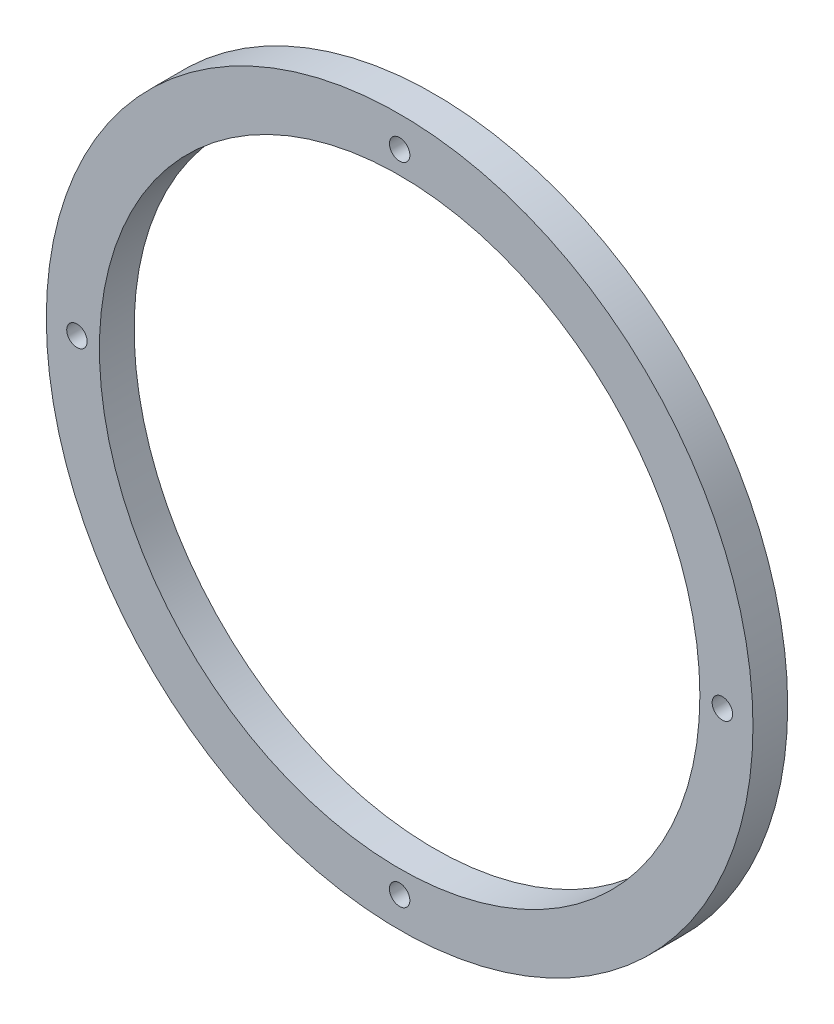
from build123d import *

# Parameters (mm, degrees)
SKETCH_1_R                   = 86.5
SKETCH_1_R_2                 = 73.5
SKETCH_1_R_3                 = 2.5
EXTRUDE_1_DEPTH              = 8.5
HOLE_WIZARD_M4_1_D           = 4.8
HOLE_WIZARD_M4_1_CSINK_D     = 9.4
HOLE_WIZARD_M4_1_CSINK_ANGLE = 90


with BuildPart() as part:
    # ｽｹｯﾁ1 → ﾎﾞｽ - 押し出し1 (new body)
    with BuildSketch(Plane.XY):
        Circle(SKETCH_1_R)
        Circle(SKETCH_1_R_2, mode=Mode.SUBTRACT)
        with Locations((0, 79)):
            Circle(SKETCH_1_R_3, mode=Mode.SUBTRACT)
        with Locations((79, 0)):
            Circle(SKETCH_1_R_3, mode=Mode.SUBTRACT)
        with Locations((0, -79)):
            Circle(SKETCH_1_R_3, mode=Mode.SUBTRACT)
        with Locations((-79, 0)):
            Circle(SKETCH_1_R_3, mode=Mode.SUBTRACT)
    extrude(amount=EXTRUDE_1_DEPTH)

    # M4 丸皿ねじ用皿穴1 (through all)
    with Locations(Plane(origin=(0, 0, 0), x_dir=(-1, 0, 0), z_dir=(0, 0, -1))):
        with Locations((-79, 0), (79, 0), (0, 79), (0, -79)):
            CounterSinkHole(HOLE_WIZARD_M4_1_D / 2, HOLE_WIZARD_M4_1_CSINK_D / 2, counter_sink_angle=HOLE_WIZARD_M4_1_CSINK_ANGLE)


solid = part.part
